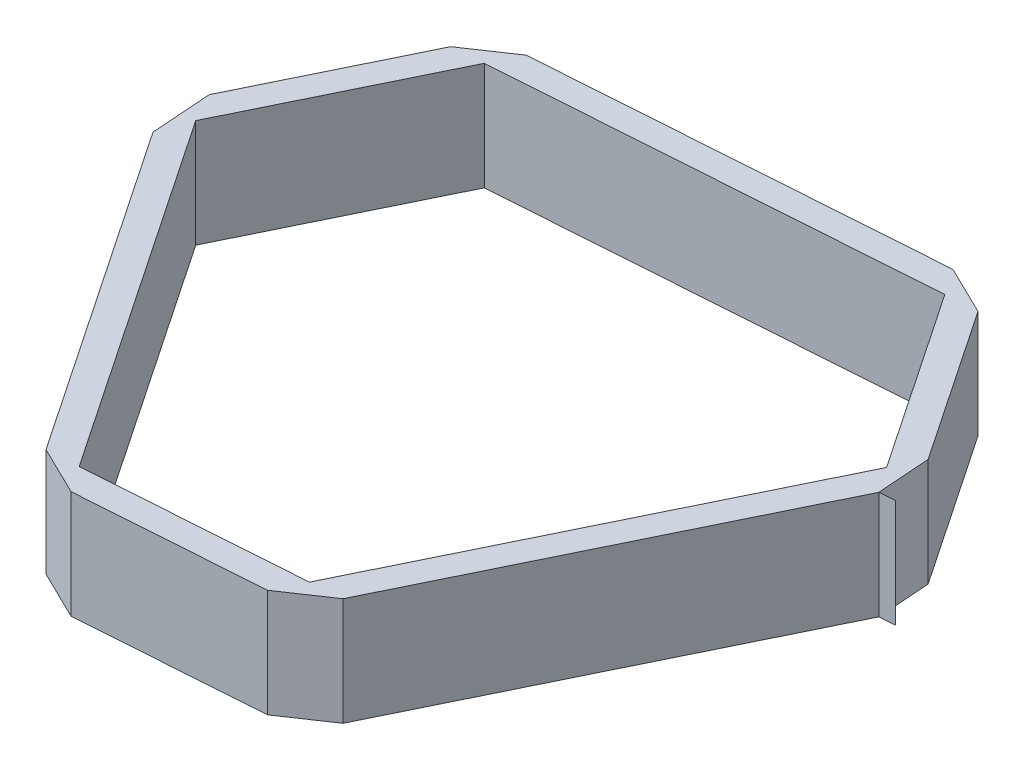
from build123d import *

# Parameters (mm, degrees)
BOSS_EXTRUDE1_DEPTH = 25.4
BOSS_EXTRUDE2_DEPTH = 25.4
SKETCH3_R           = 2
BOSS_EXTRUDE3_DEPTH = 5
CUT_EXTRUDE1_DEPTH  = 25.4
CUT_EXTRUDE7_DEPTH  = 25.4
CUT_EXTRUDE8_DEPTH  = 25.4


with BuildPart() as part:
    # Sketch1 → Boss-Extrude1 (new body)
    with BuildSketch(Plane(origin=(0, 0, 0), x_dir=(1, 0, 0), z_dir=(0, 1, 0))):
        Polygon((83.176569024, -44.663089882), (25.185203896, -48.709261314), (-35.715075295, 41.609133969), (-10.223479979, 93.854215086), (98.44468436, 101.436206322), (130.944454172, 53.237296637), align=None)
        Polygon((28.400509379, -42.119485598), (-28.400509379, 42.119485598), (-6.124219546, 87.774790999), (95.229378877, 94.846430606), (123.629888256, 52.726945008), (79.07730859, -38.583665795), align=None, mode=Mode.SUBTRACT)
    extrude(amount=BOSS_EXTRUDE1_DEPTH)

    # Sketch2 → Boss-Extrude2 (add)
    with BuildSketch(Plane(origin=(0, 25.4, 0), x_dir=(1, 0, 0), z_dir=(0, 1, 0))):
        Polygon((123.193813482, 58.976945008), (124.063847882, 46.507260162), (131.411983768, 47.019954034), (130.541949367, 59.489638879), align=None)
    extrude(amount=-BOSS_EXTRUDE2_DEPTH)

    # Sketch3 → Boss-Extrude3 (add)
    with BuildSketch(Plane(origin=(134.040133914, 0, -9.35224338), x_dir=(-0.06960275203236939, 0, -0.9975747876272337), z_dir=(0.9975747876272337, 0, -0.06960275203236939))):
        with Locations(Location((41.009284939, 23.4, 0), (0, 0, 90))):
            Circle(SKETCH3_R)
        with Locations(Location((47.009284939, 23.4, 0), (0, 0, 180))):
            Circle(SKETCH3_R)
    extrude(amount=BOSS_EXTRUDE3_DEPTH)

    # Sketch4 → Cut-Extrude1 (cut)
    with BuildSketch(Plane(origin=(0, 25.4, 0), x_dir=(1, 0, 0), z_dir=(0, 1, 0))):
        Polygon((126.899940216, 59.235528748), (127.787477079, 46.767065084), (139.380441548, 47.592281694), (138.492904685, 60.060745358), align=None)
    extrude(amount=-CUT_EXTRUDE1_DEPTH, mode=Mode.SUBTRACT)


with BuildPart() as cut_extrude1_piece_1:
    # of the separate pieces the step leaves, piece 1, a body of its own (cut_extrude1_pieces)
    add(part.part.solids().sort_by_distance((83.176569024, 0, 44.663089882))[0])

    # Sketch5 → Cut-Extrude7 (cut)
    with BuildSketch(Plane(origin=(0, 25.4, 0), x_dir=(1, 0, 0), z_dir=(0, 1, 0))):
        Polygon((-31.092418985, 34.753485598), (-32.089237801, 49.040295952), (-35.715075295, 41.609133969), align=None)
    extrude(amount=-CUT_EXTRUDE7_DEPTH, mode=Mode.SUBTRACT)

    # Sketch7 → Cut-Extrude8 (cut)
    with BuildSketch(Plane(origin=(0, 25.4, 0), x_dir=(1, 0, 0), z_dir=(0, 1, 0))):
        Polygon((75.795317069, -45.178094326), (86.421188069, -38.013235955), (83.176569024, -44.663089882), align=None)
        Polygon((21.048570986, -42.574411832), (25.185203896, -48.709261314), (32.56645585, -48.194256869), align=None)
        Polygon((-10.223479979, 93.854215086), (-2.842228025, 94.369219531), (-13.468099024, 87.20436116), align=None)
        Polygon((91.063432406, 100.921201877), (98.44468436, 101.436206322), (102.581317269, 95.30135684), align=None)
    extrude(amount=-CUT_EXTRUDE8_DEPTH, mode=Mode.SUBTRACT)


with BuildPart() as cut_extrude1_piece_2:
    # of the separate pieces the step leaves, piece 2, a body of its own (cut_extrude1_pieces)
    add(part.part.solids().sort_by_distance((131.411983768, 25.4, -47.019954034))[0])


solid = Compound([cut_extrude1_piece_1.part, cut_extrude1_piece_2.part])
